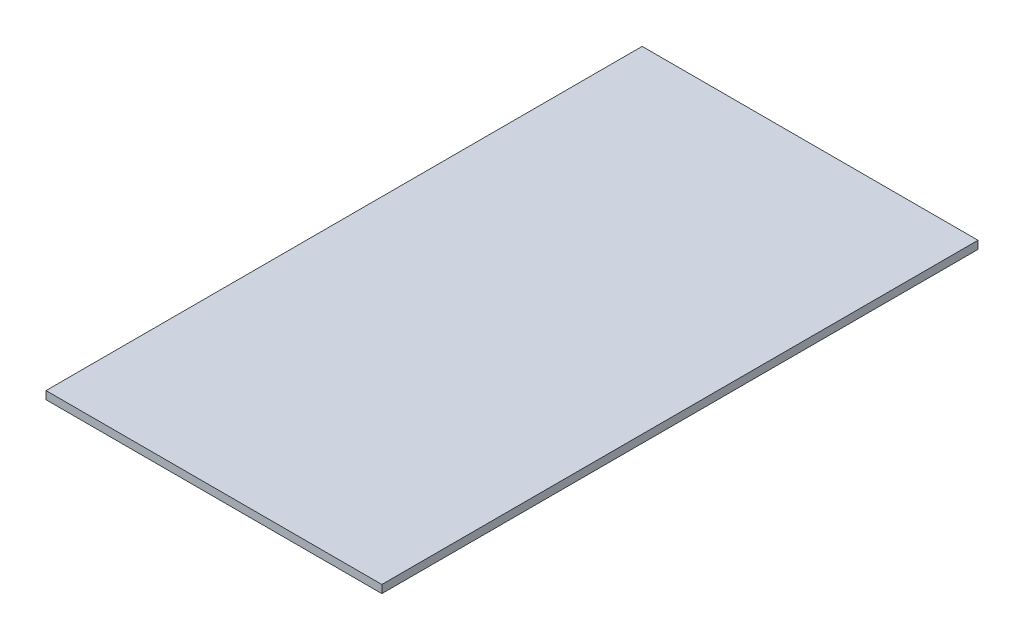
from build123d import *

# Parameters (mm, degrees)
SKETCH1_W           = 338
SKETCH1_H           = 600
BOSS_EXTRUDE1_DEPTH = 8


with BuildPart() as part:
    # Sketch1 → Boss-Extrude1 (new body)
    with BuildSketch(Plane(origin=(0, 0, 0), x_dir=(1, 0, 0), z_dir=(0, 1, 0))):
        with Locations((169, 300)):
            Rectangle(SKETCH1_W, SKETCH1_H)
    extrude(amount=BOSS_EXTRUDE1_DEPTH)


solid = part.part
